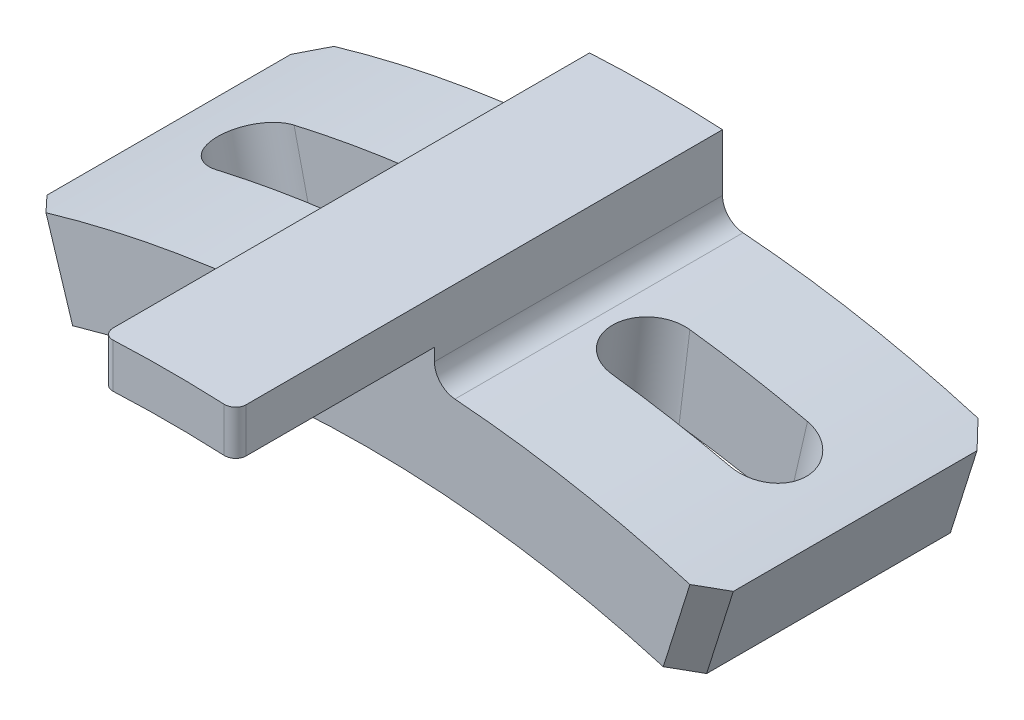
from build123d import *

# Parameters (mm, degrees)
EXTRUDE_1_DEPTH          = 6.5
EXTRUDE_START            = 9
EXTRUDE_2_DEPTH          = 9
PATTERN_CIRCULAR_1_COUNT = 2
PATTERN_CIRCULAR_1_ANGLE = 6
CUT_EXTRUDE_2_DEPTH      = 1.75
FILLET_1_R               = 1
CHAMFER_1_SIZE           = 1
FILLET_2_R               = 0.5


with BuildPart() as part:
    # Эскиз1 → Бобышка-Вытянуть1 (new, symmetric)
    with BuildSketch(Plane.XY):
        with BuildLine():
            Line((14.283525476, 45.301555161), (15.486348674, 49.116422964))
            ThreePointArc((15.486348674, 49.116422964), (9.314199823, 50.65072242), (3, 51.412547107))
            Line((3, 51.412547107), (3, 54.918120871))
            ThreePointArc((3, 54.918120871), (0, 55), (-3, 54.918120871))
            Line((-3, 54.918120871), (-3, 51.412547107))
            ThreePointArc((-3, 51.412547107), (-9.314199823, 50.65072242), (-15.486348674, 49.116422964))
            Line((-15.486348674, 49.116422964), (-14.283525476, 45.301555161))
            ThreePointArc((-14.283525476, 45.301555161), (0, 47.5), (14.283525476, 45.301555161))
        make_face()
    extrude(amount=EXTRUDE_1_DEPTH, both=True)

    # Эскиз2 → Бобышка-Вытянуть2 (add)
    with BuildSketch(Plane.XY.offset(6.5).offset(EXTRUDE_START)):
        with BuildLine():
            Line((3, 52.915026221), (3, 54.918120871))
            ThreePointArc((3, 54.918120871), (0, 55), (-3, 54.918120871))
            Line((-3, 54.918120871), (-3, 52.915026221))
            ThreePointArc((-3, 52.915026221), (0, 53), (3, 52.915026221))
        make_face()
    extrude(amount=-EXTRUDE_2_DEPTH)

    # Эскиз4 → Вырез-Повернуть1 (revolve, cut)
    with BuildSketch(Plane.XY):
        Polygon((15.202210874, 58.068539542), (10.703189787, 38.581138246), (8.998042174, 38.974802591), (13.497063261, 58.462203887), align=None)
    cut_revolve_1 = revolve(axis=Axis((0, 0, 0), (0.22495105434386545, 0.9743700647852351, 0)), mode=Mode.SUBTRACT)

    # Круговой массив1: Вырез-Повернуть1 ×2 about axis
    pattern_circular_1_axis = Axis((0, 0, 6.5), (0, 0, 1))
    for i in range(1, PATTERN_CIRCULAR_1_COUNT):
        add(cut_revolve_1.rotate(pattern_circular_1_axis, i * PATTERN_CIRCULAR_1_ANGLE / (PATTERN_CIRCULAR_1_COUNT - 1)), mode=Mode.SUBTRACT)

    # Эскиз6 → Вырез-Вытянуть2 (cut, symmetric)
    with BuildSketch(Plane.XY):
        with BuildLine():
            Line((5.788793812, 47.145942203), (6.276271185, 51.11612681))
            ThreePointArc((6.276271185, 51.11612681), (8.94288115, 50.71759928), (11.584979299, 50.180058336))
            Line((11.584979299, 50.180058336), (10.685175081, 46.282578077))
            ThreePointArc((10.685175081, 46.282578077), (8.248288439, 46.778368268), (5.788793812, 47.145942203))
        make_face()
    cut_extrude_2 = extrude(amount=CUT_EXTRUDE_2_DEPTH, both=True, mode=Mode.SUBTRACT)

    # Зеркальное отражение1: Вырез-Повернуть1, Вырез-Вытянуть2 across plane
    add(cut_revolve_1.mirror(Plane(origin=(0, 0, 0), x_dir=(0, 0, 1), z_dir=(1, 0, 0))), mode=Mode.SUBTRACT)
    add(cut_extrude_2.mirror(Plane(origin=(0, 0, 0), x_dir=(0, 0, 1), z_dir=(1, 0, 0))), mode=Mode.SUBTRACT)

    # Зеркальное отражение1 copy 1 sketch → Зеркальное отражение1 copy 1 (revolve, cut)
    with BuildSketch(Plane(origin=(0, 0, 0), x_dir=(-0.9945218953682733, 0.10452846326765369, 0), z_dir=(0, 0, 1))):
        Polygon((15.202210874, -58.068539542), (10.703189787, -38.581138246), (8.998042174, -38.974802591), (13.497063261, -58.462203887), align=None)
    revolve(axis=Axis((0, 0, 0), (0.12186934340514771, -0.992546151641322, 0)), mode=Mode.SUBTRACT)

    # Скругление1
    fillet_1_edges = [part.edges().sort_by_distance(p)[0] for p in [
        (-3, 51.412547107, 0),
        (3, 51.412547107, 0),
    ]]
    fillet(fillet_1_edges, radius=FILLET_1_R)

    # Фаска1
    chamfer_1_edges = [part.edges().sort_by_distance(p)[0] for p in [
        (14.884937075, 47.208989062, -6.5),
        (-14.884937075, 47.208989062, 6.5),
        (-14.884937075, 47.208989062, -6.5),
        (14.884937075, 47.208989062, 6.5),
    ]]
    chamfer(chamfer_1_edges, length=CHAMFER_1_SIZE)

    # Скругление2
    fillet_2_edges = [part.edges().sort_by_distance(p)[0] for p in [
        (-3, 53.916573546, 15.5),
        (3, 53.916573546, 15.5),
    ]]
    fillet(fillet_2_edges, radius=FILLET_2_R)


solid = part.part
